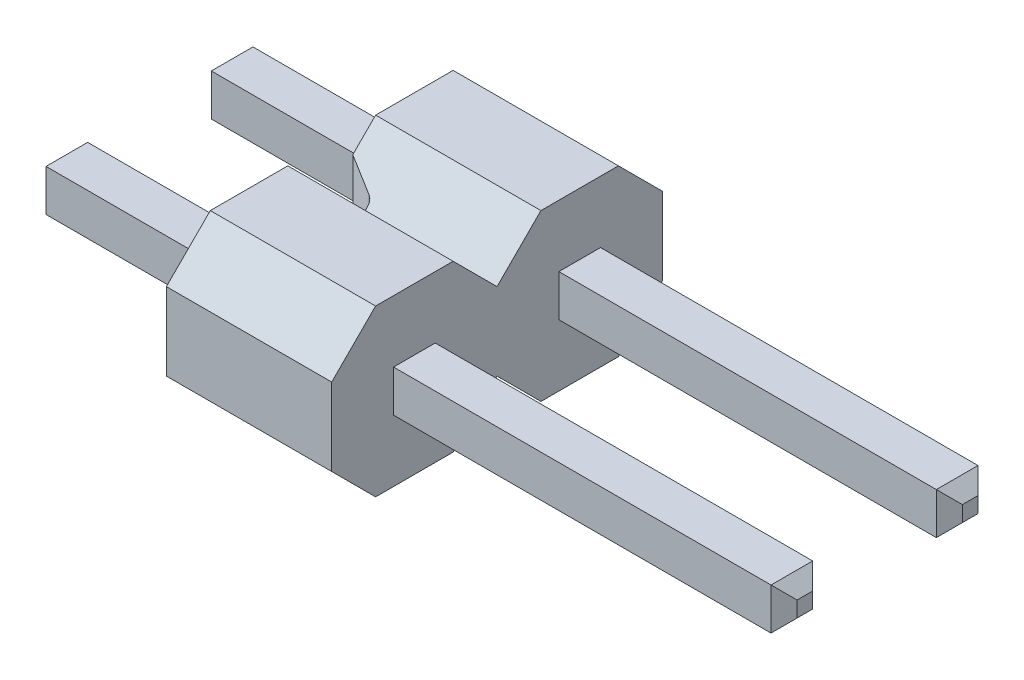
from build123d import *

# Parameters (mm, degrees)
CROQUIS1_W                     = 0.64
CROQUIS1_H                     = 0.64
SALIENTE_EXTRUIR1_DEPTH        = 2.54
CORTAR_EXTRUIR1_DEPTH          = 2.54
CORTAR_EXTRUIR1_DEPTH_BACK     = 2.54
SALIENTE_EXTRUIR2_DEPTH        = 8.54
SALIENTE_EXTRUIR2_DEPTH_BACK   = 3
CROQUIS3_W                     = 0.64
CROQUIS3_H                     = 0.64
SALIENTE_EXTRUIR2_2_DEPTH      = 8.54
SALIENTE_EXTRUIR2_2_DEPTH_BACK = 3
CHAFL_N1_SIZE                  = 0.2
CHAFL_N2_SIZE                  = 0.2


with BuildPart() as part:
    # Croquis1 → Saliente-Extruir1 (new body)
    with BuildSketch(Plane(origin=(0, 0, 0), x_dir=(0, 0, -1), z_dir=(1, 0, 0))):
        Polygon((0.595482683, 1.27), (-0.595482683, 1.27), (-1.27, 0.595482683), (-1.27, -0.595482683), (-0.595482683, -1.27), (0.595482683, -1.27), (1.27, -0.595482683), (1.944517317, -1.27), (3.135482683, -1.27), (3.81, -0.595482683), (3.81, 0.595482683), (3.135482683, 1.27), (1.944517317, 1.27), (1.27, 0.595482683), align=None)
        Rectangle(CROQUIS1_W, CROQUIS1_H, mode=Mode.SUBTRACT)
        with Locations((2.54, 0)):
            Rectangle(CROQUIS1_W, CROQUIS1_H, mode=Mode.SUBTRACT)
    extrude(amount=SALIENTE_EXTRUIR1_DEPTH)

    # Croquis2 → Cortar-Extruir1 (cut, two sides: drawn at the far end of the back side and taken through both)
    with BuildSketch(Plane(origin=(0, 0, 0), x_dir=(1, 0, 0), z_dir=(0, 1, 0)).offset(-CORTAR_EXTRUIR1_DEPTH_BACK)):
        with BuildLine():
            Line((0.516526244, 1.243275937), (0.516526244, 1.296724063))
            ThreePointArc((0.516526244, 1.296724063), (0.500491193, 1.351036929), (0.457528496, 1.387931603))
            Line((0.457528496, 1.387931603), (0, 1.593613049))
            Line((0, 1.593613049), (0, 0.946386951))
            Line((0, 0.946386951), (0.457528496, 1.152068397))
            ThreePointArc((0.457528496, 1.152068397), (0.500491193, 1.188963071), (0.516526244, 1.243275937))
        make_face()
    extrude(amount=CORTAR_EXTRUIR1_DEPTH + CORTAR_EXTRUIR1_DEPTH_BACK, mode=Mode.SUBTRACT)


with BuildPart() as body_2:
    # Croquis3 → Saliente-Extruir2 (new, two sides: drawn at the far end of the back side and taken through both)
    with BuildSketch(Plane(origin=(0, 0, 0), x_dir=(0, 0, -1), z_dir=(1, 0, 0)).offset(-SALIENTE_EXTRUIR2_DEPTH_BACK)):
        Rectangle(CROQUIS3_W, CROQUIS3_H)
    extrude(amount=SALIENTE_EXTRUIR2_DEPTH + SALIENTE_EXTRUIR2_DEPTH_BACK)

    # Chaflán1
    chafl_n1_edges = [body_2.edges().sort_by_distance(p)[0] for p in [
        (-3, -0.32, 0),
        (-3, 0, -0.32),
        (-3, 0.32, 0),
        (-3, 0, 0.32),
        (8.54, 0.32, 0),
        (8.54, 0, -0.32),
        (8.54, -0.32, 0),
        (8.54, 0, 0.32),
    ]]
    chamfer(chafl_n1_edges, length=CHAFL_N1_SIZE)


with BuildPart() as body_3:
    # Croquis3 → Saliente-Extruir2 2 (new, two sides: drawn at the far end of the back side and taken through both)
    with BuildSketch(Plane(origin=(0, 0, 0), x_dir=(0, 0, -1), z_dir=(1, 0, 0)).offset(-SALIENTE_EXTRUIR2_2_DEPTH_BACK)):
        with Locations((2.54, 0)):
            Rectangle(CROQUIS3_W, CROQUIS3_H)
    extrude(amount=SALIENTE_EXTRUIR2_2_DEPTH + SALIENTE_EXTRUIR2_2_DEPTH_BACK)

    # Chaflán2
    chafl_n2_edges = [body_3.edges().sort_by_distance(p)[0] for p in [
        (8.54, 0.32, -2.54),
        (8.54, 0, -2.86),
        (8.54, -0.32, -2.54),
        (8.54, 0, -2.22),
        (-3, -0.32, -2.54),
        (-3, 0, -2.86),
        (-3, 0.32, -2.54),
        (-3, 0, -2.22),
    ]]
    chamfer(chafl_n2_edges, length=CHAFL_N2_SIZE)


solid = Compound([part.part, body_2.part, body_3.part])
